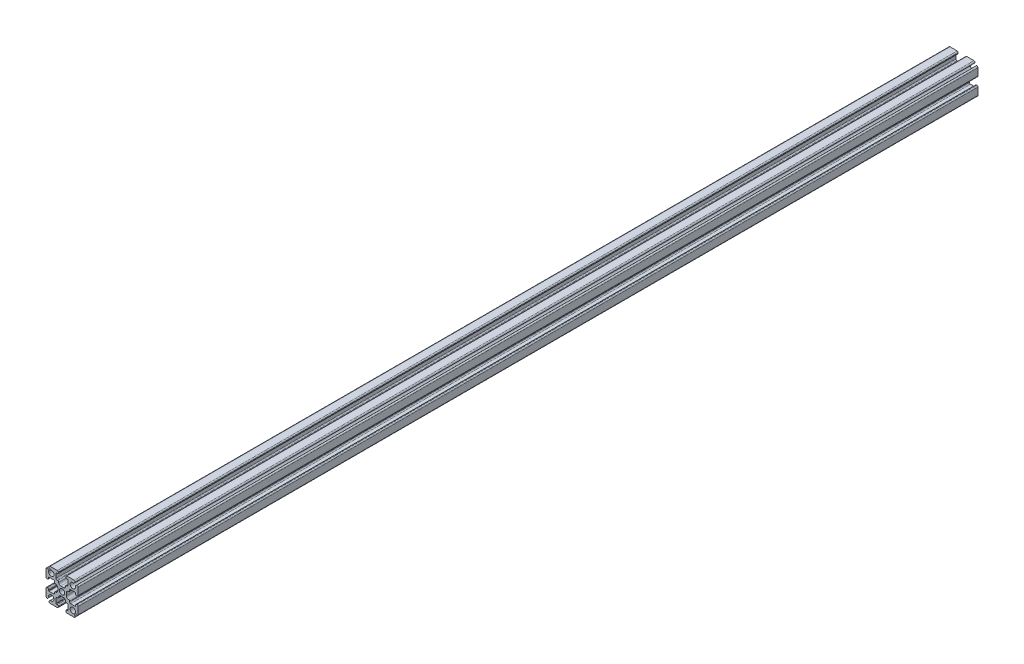
from build123d import *

# Parameters (mm, degrees)
SKETCH1_R           = 1.25
BOSS_EXTRUDE1_DEPTH = 420


with BuildPart() as part:
    # Sketch1 → Boss-Extrude1 (new body)
    with BuildSketch(Plane.XY):
        with BuildLine():
            Line((6.646446609, 5.939339828), (6.163645978, 5.456539197))
            ThreePointArc((6.163645978, 5.456539197), (4.116116524, 4.116116524), (5.456539197, 6.163645978))
            Line((5.456539197, 6.163645978), (5.939339828, 6.646446609))
            ThreePointArc((5.939339828, 6.646446609), (6.047726204, 7.191341716), (5.585786438, 7.5))
            Line((5.585786438, 7.5), (2.25, 7.5))
            ThreePointArc((2.25, 7.5), (1.896446609, 7.353553391), (1.75, 7))
            Line((1.75, 7), (1.75, 6.8))
            ThreePointArc((1.75, 6.8), (1.896446609, 6.446446609), (2.25, 6.3))
            Line((2.25, 6.3), (2.65, 6.3))
            ThreePointArc((2.65, 6.3), (2.791421356, 6.241421356), (2.85, 6.1))
            Line((2.85, 6.1), (2.85, 4))
            ThreePointArc((2.85, 4), (2.703553391, 3.646446609), (2.35, 3.5))
            Line((2.35, 3.5), (2.1, 3.5))
            ThreePointArc((2.1, 3.5), (1.746446609, 3.353553391), (1.6, 3))
            ThreePointArc((1.6, 3), (1.307106781, 2.292893219), (0.6, 2))
            Line((0.6, 2), (-0.6, 2))
            ThreePointArc((-0.6, 2), (-1.307106781, 2.292893219), (-1.6, 3))
            ThreePointArc((-1.6, 3), (-1.746446609, 3.353553391), (-2.1, 3.5))
            Line((-2.1, 3.5), (-2.35, 3.5))
            ThreePointArc((-2.35, 3.5), (-2.703553391, 3.646446609), (-2.85, 4))
            Line((-2.85, 4), (-2.85, 6.1))
            ThreePointArc((-2.85, 6.1), (-2.791421356, 6.241421356), (-2.65, 6.3))
            Line((-2.65, 6.3), (-2.25, 6.3))
            ThreePointArc((-2.25, 6.3), (-1.896446609, 6.446446609), (-1.75, 6.8))
            Line((-1.75, 6.8), (-1.75, 7))
            ThreePointArc((-1.75, 7), (-1.896446609, 7.353553391), (-2.25, 7.5))
            Line((-2.25, 7.5), (-5.585786438, 7.5))
            ThreePointArc((-5.585786438, 7.5), (-6.047726204, 7.191341716), (-5.939339828, 6.646446609))
            Line((-5.939339828, 6.646446609), (-5.456539197, 6.163645978))
            ThreePointArc((-5.456539197, 6.163645978), (-4.116116524, 4.116116524), (-6.163645978, 5.456539197))
            Line((-6.163645978, 5.456539197), (-6.646446609, 5.939339828))
            ThreePointArc((-6.646446609, 5.939339828), (-7.191341716, 6.047726204), (-7.5, 5.585786438))
            Line((-7.5, 5.585786438), (-7.5, 2.25))
            ThreePointArc((-7.5, 2.25), (-7.353553391, 1.896446609), (-7, 1.75))
            Line((-7, 1.75), (-6.8, 1.75))
            ThreePointArc((-6.8, 1.75), (-6.446446609, 1.896446609), (-6.3, 2.25))
            Line((-6.3, 2.25), (-6.3, 2.65))
            ThreePointArc((-6.3, 2.65), (-6.241421356, 2.791421356), (-6.1, 2.85))
            Line((-6.1, 2.85), (-4, 2.85))
            ThreePointArc((-4, 2.85), (-3.646446609, 2.703553391), (-3.5, 2.35))
            Line((-3.5, 2.35), (-3.5, 2.1))
            ThreePointArc((-3.5, 2.1), (-3.353553391, 1.746446609), (-3, 1.6))
            ThreePointArc((-3, 1.6), (-2.292893219, 1.307106781), (-2, 0.6))
            Line((-2, 0.6), (-2, -0.6))
            ThreePointArc((-2, -0.6), (-2.292893219, -1.307106781), (-3, -1.6))
            ThreePointArc((-3, -1.6), (-3.353553391, -1.746446609), (-3.5, -2.1))
            Line((-3.5, -2.1), (-3.5, -2.35))
            ThreePointArc((-3.5, -2.35), (-3.646446609, -2.703553391), (-4, -2.85))
            Line((-4, -2.85), (-6.1, -2.85))
            ThreePointArc((-6.1, -2.85), (-6.241421356, -2.791421356), (-6.3, -2.65))
            Line((-6.3, -2.65), (-6.3, -2.25))
            ThreePointArc((-6.3, -2.25), (-6.446446609, -1.896446609), (-6.8, -1.75))
            Line((-6.8, -1.75), (-7, -1.75))
            ThreePointArc((-7, -1.75), (-7.353553391, -1.896446609), (-7.5, -2.25))
            Line((-7.5, -2.25), (-7.5, -5.585786438))
            ThreePointArc((-7.5, -5.585786438), (-7.191341716, -6.047726204), (-6.646446609, -5.939339828))
            Line((-6.646446609, -5.939339828), (-6.163645978, -5.456539197))
            ThreePointArc((-6.163645978, -5.456539197), (-4.116116524, -4.116116524), (-5.456539197, -6.163645978))
            Line((-5.456539197, -6.163645978), (-5.939339828, -6.646446609))
            ThreePointArc((-5.939339828, -6.646446609), (-6.047726204, -7.191341716), (-5.585786438, -7.5))
            Line((-5.585786438, -7.5), (-2.25, -7.5))
            ThreePointArc((-2.25, -7.5), (-1.896446609, -7.353553391), (-1.75, -7))
            Line((-1.75, -7), (-1.75, -6.8))
            ThreePointArc((-1.75, -6.8), (-1.896446609, -6.446446609), (-2.25, -6.3))
            Line((-2.25, -6.3), (-2.65, -6.3))
            ThreePointArc((-2.65, -6.3), (-2.791421356, -6.241421356), (-2.85, -6.1))
            Line((-2.85, -6.1), (-2.85, -4))
            ThreePointArc((-2.85, -4), (-2.703553391, -3.646446609), (-2.35, -3.5))
            Line((-2.35, -3.5), (-2.1, -3.5))
            ThreePointArc((-2.1, -3.5), (-1.746446609, -3.353553391), (-1.6, -3))
            ThreePointArc((-1.6, -3), (-1.307106781, -2.292893219), (-0.6, -2))
            Line((-0.6, -2), (0.6, -2))
            ThreePointArc((0.6, -2), (1.307106781, -2.292893219), (1.6, -3))
            ThreePointArc((1.6, -3), (1.746446609, -3.353553391), (2.1, -3.5))
            Line((2.1, -3.5), (2.35, -3.5))
            ThreePointArc((2.35, -3.5), (2.703553391, -3.646446609), (2.85, -4))
            Line((2.85, -4), (2.85, -6.1))
            ThreePointArc((2.85, -6.1), (2.791421356, -6.241421356), (2.65, -6.3))
            Line((2.65, -6.3), (2.25, -6.3))
            ThreePointArc((2.25, -6.3), (1.896446609, -6.446446609), (1.75, -6.8))
            Line((1.75, -6.8), (1.75, -7))
            ThreePointArc((1.75, -7), (1.896446609, -7.353553391), (2.25, -7.5))
            Line((2.25, -7.5), (5.585786438, -7.5))
            ThreePointArc((5.585786438, -7.5), (6.047726204, -7.191341716), (5.939339828, -6.646446609))
            Line((5.939339828, -6.646446609), (5.456539197, -6.163645978))
            ThreePointArc((5.456539197, -6.163645978), (4.116116524, -4.116116524), (6.163645978, -5.456539197))
            Line((6.163645978, -5.456539197), (6.646446609, -5.939339828))
            ThreePointArc((6.646446609, -5.939339828), (7.191341716, -6.047726204), (7.5, -5.585786438))
            Line((7.5, -5.585786438), (7.5, -2.25))
            ThreePointArc((7.5, -2.25), (7.353553391, -1.896446609), (7, -1.75))
            Line((7, -1.75), (6.8, -1.75))
            ThreePointArc((6.8, -1.75), (6.446446609, -1.896446609), (6.3, -2.25))
            Line((6.3, -2.25), (6.3, -2.65))
            ThreePointArc((6.3, -2.65), (6.241421356, -2.791421356), (6.1, -2.85))
            Line((6.1, -2.85), (4, -2.85))
            ThreePointArc((4, -2.85), (3.646446609, -2.703553391), (3.5, -2.35))
            Line((3.5, -2.35), (3.5, -2.1))
            ThreePointArc((3.5, -2.1), (3.353553391, -1.746446609), (3, -1.6))
            ThreePointArc((3, -1.6), (2.292893219, -1.307106781), (2, -0.6))
            Line((2, -0.6), (2, 0.6))
            ThreePointArc((2, 0.6), (2.292893219, 1.307106781), (3, 1.6))
            ThreePointArc((3, 1.6), (3.353553391, 1.746446609), (3.5, 2.1))
            Line((3.5, 2.1), (3.5, 2.35))
            ThreePointArc((3.5, 2.35), (3.646446609, 2.703553391), (4, 2.85))
            Line((4, 2.85), (6.1, 2.85))
            ThreePointArc((6.1, 2.85), (6.241421356, 2.791421356), (6.3, 2.65))
            Line((6.3, 2.65), (6.3, 2.25))
            ThreePointArc((6.3, 2.25), (6.446446609, 1.896446609), (6.8, 1.75))
            Line((6.8, 1.75), (7, 1.75))
            ThreePointArc((7, 1.75), (7.353553391, 1.896446609), (7.5, 2.25))
            Line((7.5, 2.25), (7.5, 5.585786438))
            ThreePointArc((7.5, 5.585786438), (7.191341716, 6.047726204), (6.646446609, 5.939339828))
        make_face()
        with Locations(Location((0, 0, 0), (0, 0, 180))):
            Circle(SKETCH1_R, mode=Mode.SUBTRACT)
    extrude(amount=BOSS_EXTRUDE1_DEPTH)


solid = part.part
